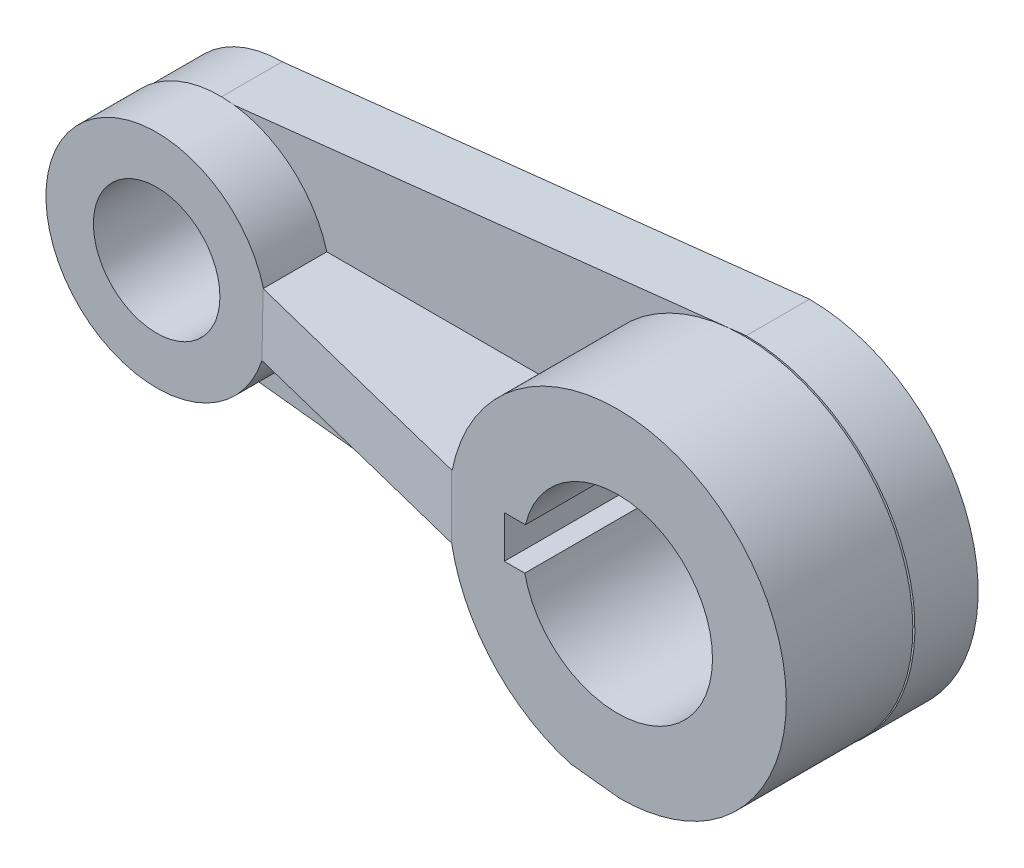
from build123d import *

# Parameters (mm, degrees)
BOSS_EXTRUDE1_DEPTH     = 12
SKETCH7_R               = 21
BOSS_EXTRUDE3_DEPTH     = 12
BOSS_EXTRUDE4_START     = 24
BOSS_EXTRUDE4_DEPTH     = 24
SKETCH9_R               = 12
SKETCH9_R_2             = 18
CUT_EXTRUDE1_DEPTH      = 94.856036825
CUT_EXTRUDE2_DEPTH      = 94.856036825
CUT_EXTRUDE2_DEPTH_BACK = 94.856036825
SKETCH9_3_R             = 12
SKETCH9_3_R_2           = 18
CUT_EXTRUDE3_DEPTH      = 98.616369777
CUT_EXTRUDE3_DEPTH_BACK = 98.616369777
BOSS_EXTRUDE5_DEPTH     = 24
CUT_EXTRUDE4_DEPTH      = 97.067453638
CUT_EXTRUDE4_DEPTH_BACK = 24


with BuildPart() as part:
    # Sketch4 → Boss-Extrude1 (new body)
    with BuildSketch(Plane.XY):
        with BuildLine():
            ThreePointArc((-47.094430993, 21), (-68.094430993, 0), (-47.094430993, -21))
            Line((-47.094430993, -21), (52.905569007, -32))
            ThreePointArc((52.905569007, -32), (84.905569007, 0), (52.905569007, 32))
            Line((52.905569007, 32), (-47.094430993, 21))
        make_face()
    extrude(amount=-BOSS_EXTRUDE1_DEPTH)

    # Sketch7 → Boss-Extrude3 (add)
    with BuildSketch(Plane.XY):
        with Locations((-46.916866089, 0.498400316)):
            Circle(SKETCH7_R)
    extrude(amount=BOSS_EXTRUDE3_DEPTH)

    # Sketch7<4> → Boss-Extrude4 (add)
    with BuildSketch(Plane.XY.offset(BOSS_EXTRUDE4_START)):
        with BuildLine():
            ThreePointArc((69.890228484, -27.120496722), (80.621286149, -15.545614643), (84.513996989, -0.249200158))
            ThreePointArc((84.513996989, -0.249200158), (33.309113789, 25.347136714), (43.56571816, -30.972616407))
            Line((43.56571816, -30.972616407), (52.905569007, -32))
            ThreePointArc((52.905569007, -32), (61.741408099, -30.755941663), (69.890228484, -27.120496722))
        make_face()
    extrude(amount=-BOSS_EXTRUDE4_DEPTH)

    # Sketch9 → Cut-Extrude1 (cut, through all)
    with BuildSketch(Plane.XY):
        with Locations((-46.916866089, 0.498400316)):
            Circle(SKETCH9_R)
        with Locations((52.513996989, -0.249200158)):
            Circle(SKETCH9_R_2)
    extrude(amount=-CUT_EXTRUDE1_DEPTH, mode=Mode.SUBTRACT)

    # Sketch9<3> → Cut-Extrude2 (cut, two sides: drawn at the far end of the back side and taken through both)
    with BuildSketch(Plane.XY.offset(-CUT_EXTRUDE2_DEPTH_BACK)):
        with Locations((-46.916866089, 0.498400316)):
            Circle(SKETCH9_3_R)
        with Locations((52.513996989, -0.249200158)):
            Circle(SKETCH9_3_R_2)
    extrude(amount=CUT_EXTRUDE2_DEPTH + CUT_EXTRUDE2_DEPTH_BACK, mode=Mode.SUBTRACT)

    # Sketch10 → Cut-Extrude3 (cut, two sides: drawn at the far end of the back side and taken through both)
    with BuildSketch(Plane.XY.offset(24).offset(-CUT_EXTRUDE3_DEPTH_BACK)):
        Polygon((35.022733512, 4), (31.022733512, 4), (31.022733512, -4), (34.909125489, -4), align=None)
    extrude(amount=CUT_EXTRUDE3_DEPTH + CUT_EXTRUDE3_DEPTH_BACK, mode=Mode.SUBTRACT)

    # Sketch11 → Boss-Extrude5 (add)
    with BuildSketch(Plane.XY):
        Polygon((-26.650332075, 6), (21.130123784, 6), (21.034983326, -6), (-26.9476199, -6), align=None)
    extrude(amount=BOSS_EXTRUDE5_DEPTH)

    # Sketch12 → Cut-Extrude4 (cut, two sides: drawn at the far end of the back side and taken through both)
    with BuildSketch(Plane.XZ.offset(6).offset(-CUT_EXTRUDE4_DEPTH_BACK)):
        Polygon((-26.9476199, 12), (21.034983326, 24), (-26.9476199, 24), align=None)
    extrude(amount=CUT_EXTRUDE4_DEPTH + CUT_EXTRUDE4_DEPTH_BACK, mode=Mode.SUBTRACT)


solid = part.part
